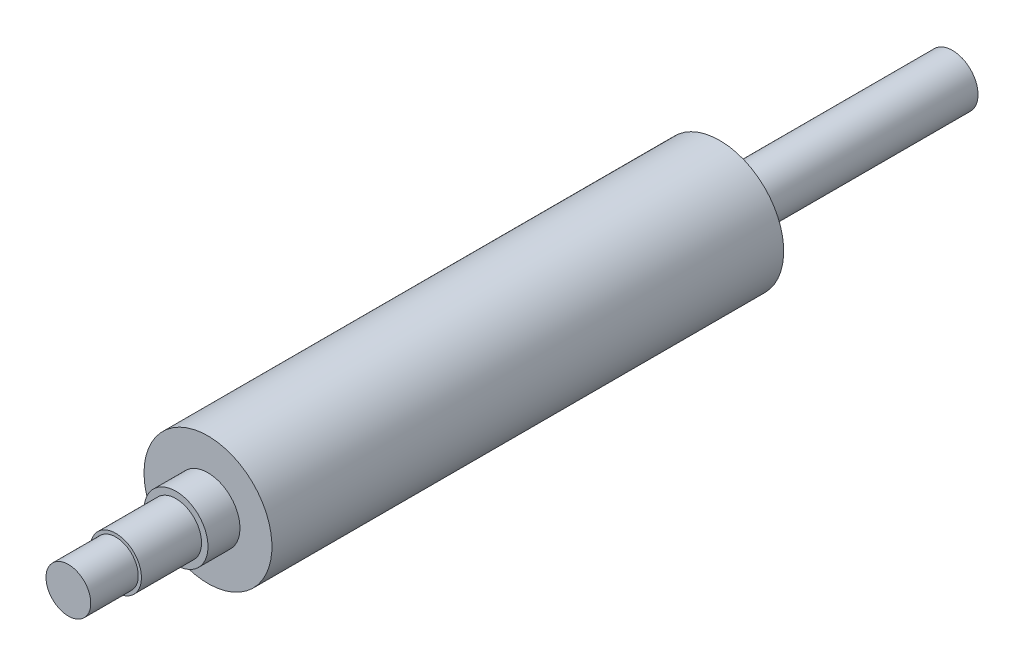
from build123d import *


with BuildPart() as part:
    # Çizim1 → Döndür1 (revolve)
    with BuildSketch(Plane(origin=(0, 0, 0), x_dir=(1, 0, 0), z_dir=(0, 1, 0)), mode=Mode.PRIVATE) as d_nd_r1_sk:
        Polygon((0, 0), (0, -138.2), (3.5, -138.2), (3.5, -130.78), (4, -130.78), (4, -121.38), (5, -121.38), (5, -116.38), (10, -116.38), (10, -36.38), (5, -36.38), (5, -32.88), (4, -32.88), (4, 0), align=None)
    revolve(d_nd_r1_sk.sketch.rotate(Axis((0, 0, 0), (0, 0, 1)), 180), axis=Axis((0, 0, 0), (0, 0, 1)))


solid = part.part
